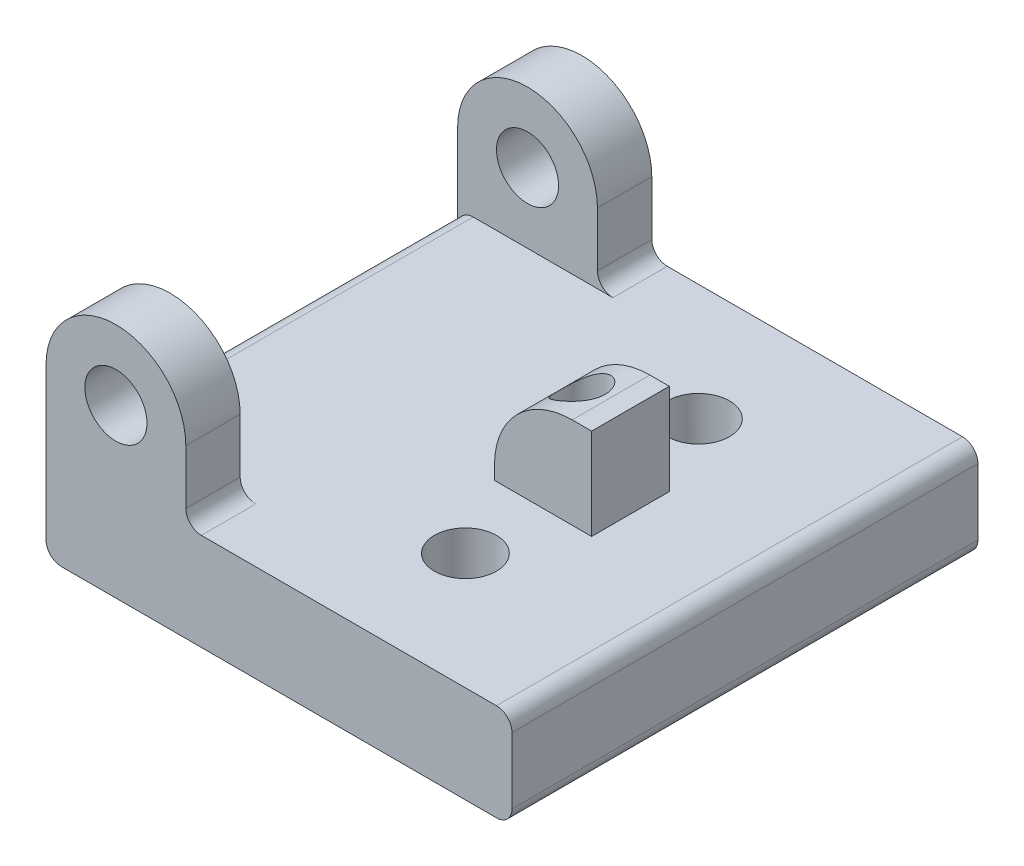
from build123d import *

# Parameters (mm, degrees)
SKETCH1_R               = 4
BOSS_EXTRUDE2_DEPTH     = 7
BOSS_EXTRUDE3_DEPTH     = 23
CUT_EXTRUDE1_DEPTH      = 74.976770002
CUT_EXTRUDE1_DEPTH_BACK = 74.976770002
SKETCH5_R               = 4
SKETCH6_W               = 12.5
SKETCH6_H               = 10
BOSS_EXTRUDE4_DEPTH     = 12.5
FILLET1_R               = 10
SKETCH8_R               = 3
CUT_EXTRUDE2_DEPTH      = 15


with BuildPart() as part:
    # Sketch1 → Boss-Extrude2 (new body)
    with BuildSketch(Plane.XY):
        with BuildLine():
            Line((-37, -11.75), (19, -11.75))
            ThreePointArc((19, -11.75), (20.414213562, -11.164213562), (21, -9.75))
            Line((21, -9.75), (21, -1.25))
            ThreePointArc((21, -1.25), (20.414213562, 0.164213562), (19, 0.75))
            Line((19, 0.75), (-19, 0.75))
            ThreePointArc((-19, 0.75), (-20.414213562, 1.335786438), (-21, 2.75))
            Line((-21, 2.75), (-21, 9.75))
            ThreePointArc((-21, 9.75), (-30, 18.75), (-39, 9.75))
            Line((-39, 9.75), (-39, -9.75))
            ThreePointArc((-39, -9.75), (-38.414213562, -11.164213562), (-37, -11.75))
        make_face()
        with Locations((-30, 9.75)):
            Circle(SKETCH1_R, mode=Mode.SUBTRACT)
    boss_extrude2 = extrude(amount=-BOSS_EXTRUDE2_DEPTH)

    # Sketch4 → Boss-Extrude3 (add)
    with BuildSketch(Plane(origin=(0, 0, -7), x_dir=(-1, 0, 0), z_dir=(0, 0, -1))):
        with BuildLine():
            Line((19, 0.75), (37, 0.75))
            ThreePointArc((37, 0.75), (38.414213562, 0.164213562), (39, -1.25))
            Line((39, -1.25), (39, -9.75))
            ThreePointArc((39, -9.75), (38.414213562, -11.164213562), (37, -11.75))
            Line((37, -11.75), (-19, -11.75))
            ThreePointArc((-19, -11.75), (-20.414213562, -11.164213562), (-21, -9.75))
            Line((-21, -9.75), (-21, -1.25))
            ThreePointArc((-21, -1.25), (-20.414213562, 0.164213562), (-19, 0.75))
            Line((-19, 0.75), (19, 0.75))
        make_face()
    boss_extrude3 = extrude(amount=BOSS_EXTRUDE3_DEPTH)

    # Mirror2: Boss-Extrude3 across plane
    add(boss_extrude3.mirror(Plane(origin=(0, 0, -30), x_dir=(1, 0, 0), z_dir=(0, 0, -1))))

    # Mirror3: Boss-Extrude2 across plane
    add(boss_extrude2.mirror(Plane(origin=(0, 0, -30), x_dir=(1, 0, 0), z_dir=(0, 0, -1))))

    # Sketch5 → Cut-Extrude1 (cut, two sides: drawn at the far end of the back side and taken through both)
    with BuildSketch(Plane(origin=(0, 0, 0), x_dir=(1, 0, 0), z_dir=(0, 1, 0)).offset(-CUT_EXTRUDE1_DEPTH_BACK)):
        with Locations(Location((0, 45, 0), (0, 0, 270))):
            Circle(SKETCH5_R)
        with Locations(Location((0, 15, 0), (0, 0, 270))):
            Circle(SKETCH5_R)
    extrude(amount=CUT_EXTRUDE1_DEPTH + CUT_EXTRUDE1_DEPTH_BACK, mode=Mode.SUBTRACT)

    # Sketch6 → Boss-Extrude4 (add)
    with BuildSketch(Plane(origin=(0, 0, 0), x_dir=(1, 0, 0), z_dir=(0, 1, 0))):
        with Locations((0, 30)):
            Rectangle(SKETCH6_W, SKETCH6_H)
    extrude(amount=BOSS_EXTRUDE4_DEPTH)

    # Fillet1
    fillet1_edges = [part.edges().sort_by_distance(p)[0] for p in [
        (-6.25, 12.5, -30),
    ]]
    fillet(fillet1_edges, radius=FILLET1_R)

    # Sketch8 → Cut-Extrude2 (cut)
    with BuildSketch(Plane(origin=(0, 12.5, 0), x_dir=(1, 0, 0), z_dir=(0, 1, 0))):
        with Locations(Location((0, 30, 0), (0, 0, 270))):
            Circle(SKETCH8_R)
    extrude(amount=-CUT_EXTRUDE2_DEPTH, mode=Mode.SUBTRACT)


solid = part.part
